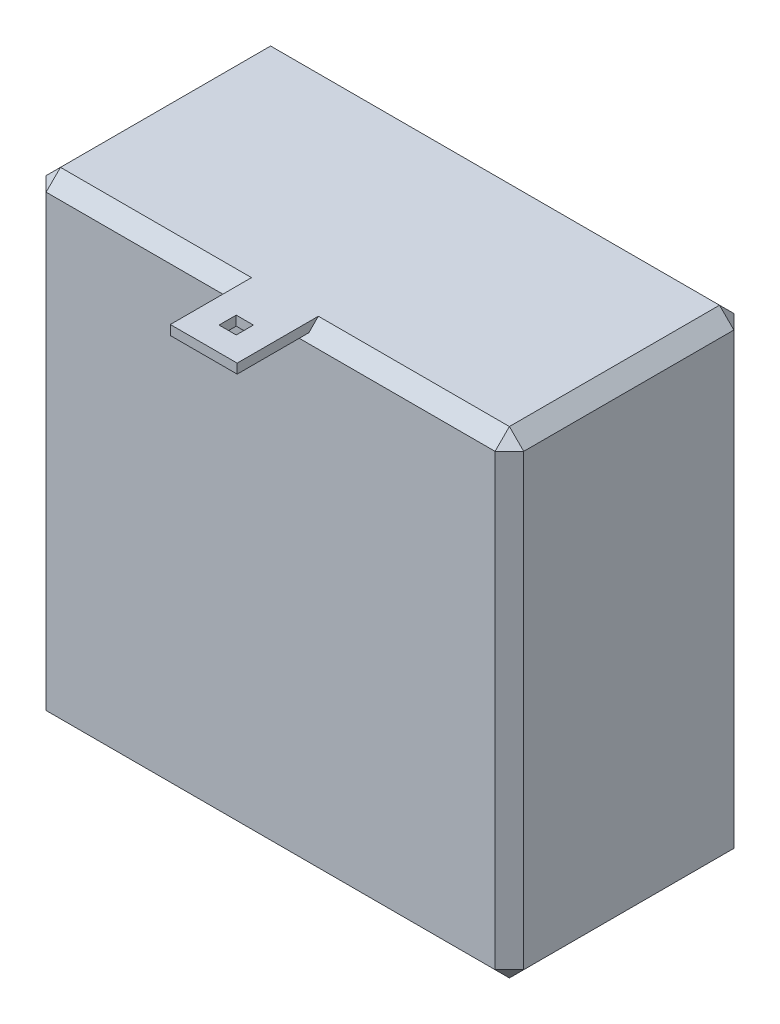
from build123d import *

# Parameters (mm, degrees)
SKETCH1_W                = 50
SKETCH1_H                = 50
BOSS_EXTRUDE1_DEPTH      = 25
CHAMFER1_SIZE            = 1.5
BOSS_EXTRUDE2_DEPTH      = 7
BOSS_EXTRUDE2_DEPTH_BACK = 10
SKETCH2_W                = 7
SKETCH2_H                = 1
SKETCH3_W                = 1.8
SKETCH3_H                = 1.8
CUT_EXTRUDE1_DEPTH       = 7


with BuildPart() as part:
    # Sketch1 → Boss-Extrude1 (new body)
    with BuildSketch(Plane.XY):
        with Locations((25, 25)):
            Rectangle(SKETCH1_W, SKETCH1_H)
    extrude(amount=BOSS_EXTRUDE1_DEPTH)

    # Chamfer1
    chamfer1_edges = [part.edges().sort_by_distance(p)[0] for p in [
        (50, 25, 25),
        (25, 50, 25),
        (0, 25, 25),
        (25, 50, 0),
        (50, 25, 0),
        (25, 0, 0),
        (0, 25, 0),
        (25, 0, 25),
        (0, 50, 12.5),
        (50, 50, 12.5),
        (50, 0, 12.5),
        (0, 0, 12.5),
    ]]
    chamfer(chamfer1_edges, length=CHAMFER1_SIZE)

    # Sketch2 → Boss-Extrude2 (add, two sides: drawn at the far end of the back side and taken through both)
    with BuildSketch(Plane.XY.offset(25).offset(-BOSS_EXTRUDE2_DEPTH_BACK)):
        with Locations((25, 49.5)):
            Rectangle(SKETCH2_W, SKETCH2_H)
    extrude(amount=BOSS_EXTRUDE2_DEPTH + BOSS_EXTRUDE2_DEPTH_BACK)

    # Sketch3 → Cut-Extrude1 (cut)
    with BuildSketch(Plane.XZ.offset(-49)):
        with Locations((25, 28.6)):
            Rectangle(SKETCH3_W, SKETCH3_H)
    extrude(amount=-CUT_EXTRUDE1_DEPTH, mode=Mode.SUBTRACT)


solid = part.part
